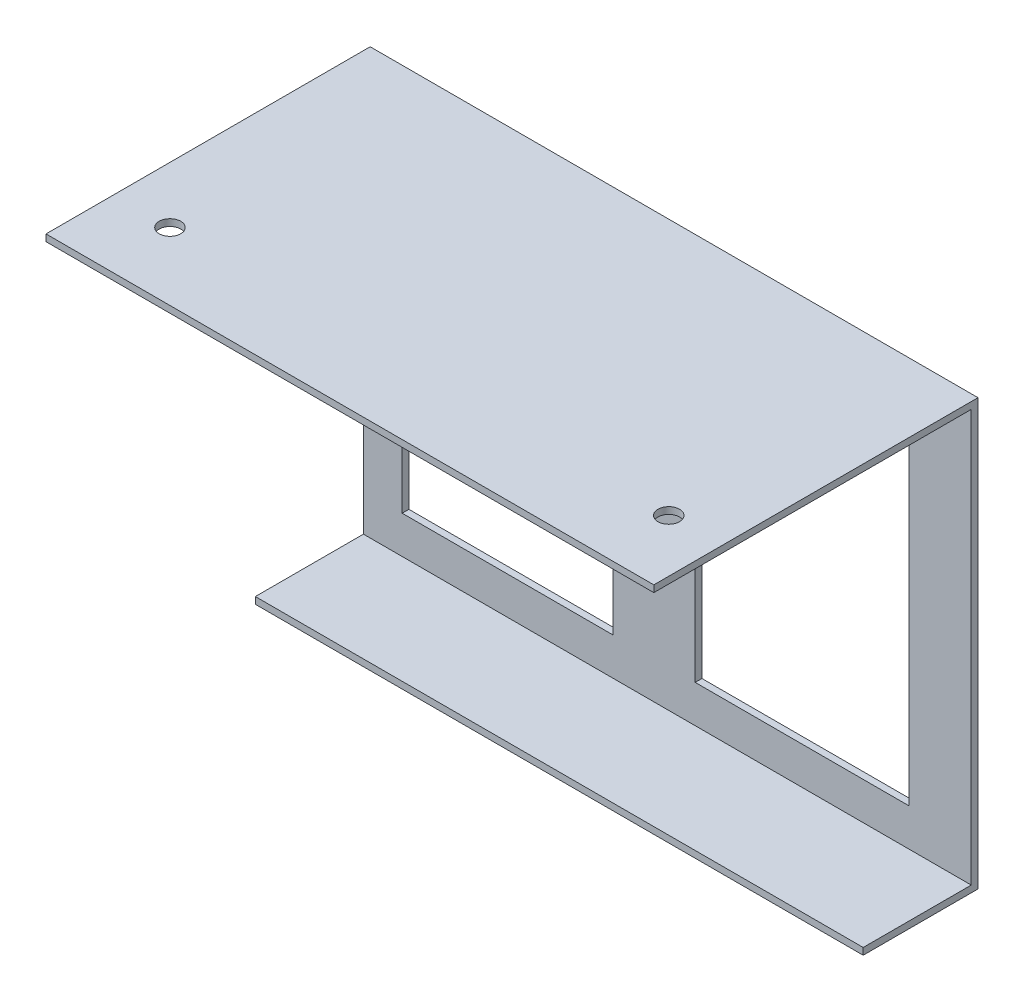
from build123d import *

# Parameters (mm, degrees)
SKETCH_1_W          = 90
SKETCH_1_H          = 63
EXTRUDE_1_DEPTH     = 1
SKETCH_2_W          = 90
SKETCH_2_H          = 1
EXTRUDE_2_DEPTH     = 47
SKETCH_3_W          = 101.367565962
SKETCH_3_H          = 1
CUT_EXTRUDE_1_DEPTH = 31
SKETCH_4_W          = 31.251975893
SKETCH_4_H          = 48.889893619
SKETCH_4_W_2        = 31.654361849
CUT_EXTRUDE_2_DEPTH = 31
SKETCH_5_R          = 1.6
CUT_EXTRUDE_3_DEPTH = 31


with BuildPart() as part:
    # 草图1 → 凸台-拉伸1 (new body)
    with BuildSketch(Plane.XY):
        with Locations((45, 31.5)):
            Rectangle(SKETCH_1_W, SKETCH_1_H)
    extrude(amount=EXTRUDE_1_DEPTH)

    # 草图2 → 凸台-拉伸2 (add)
    with BuildSketch(Plane.XY.offset(1)):
        with Locations((45, 62.5)):
            Rectangle(SKETCH_2_W, SKETCH_2_H)
        with Locations((45, 0.5)):
            Rectangle(SKETCH_2_W, SKETCH_2_H)
    extrude(amount=EXTRUDE_2_DEPTH)

    # 草图3 → 切除-拉伸1 (cut)
    with BuildSketch(Plane.XY.offset(48)):
        with Locations((50.683782981, 0.5)):
            Rectangle(SKETCH_3_W, SKETCH_3_H)
    extrude(amount=-CUT_EXTRUDE_1_DEPTH, mode=Mode.SUBTRACT)

    # 草图4 → 切除-拉伸2 (cut)
    with BuildSketch(Plane.XY.offset(1)):
        with Locations((21.359825103, 30.997017556)):
            Rectangle(SKETCH_4_W, SKETCH_4_H)
        with Locations((64.951636971, 30.997017556)):
            Rectangle(SKETCH_4_W_2, SKETCH_4_H)
    extrude(amount=-CUT_EXTRUDE_2_DEPTH, mode=Mode.SUBTRACT)

    # 草图5 → 切除-拉伸3 (cut)
    with BuildSketch(Plane.XZ.offset(-62)):
        with Locations(Location((8.358150818, 38, 0), (0, 0, 270))):
            Circle(SKETCH_5_R)
        with Locations(Location((82.205212472, 38, 0), (0, 0, 270))):
            Circle(SKETCH_5_R)
    extrude(amount=-CUT_EXTRUDE_3_DEPTH, mode=Mode.SUBTRACT)


solid = part.part
